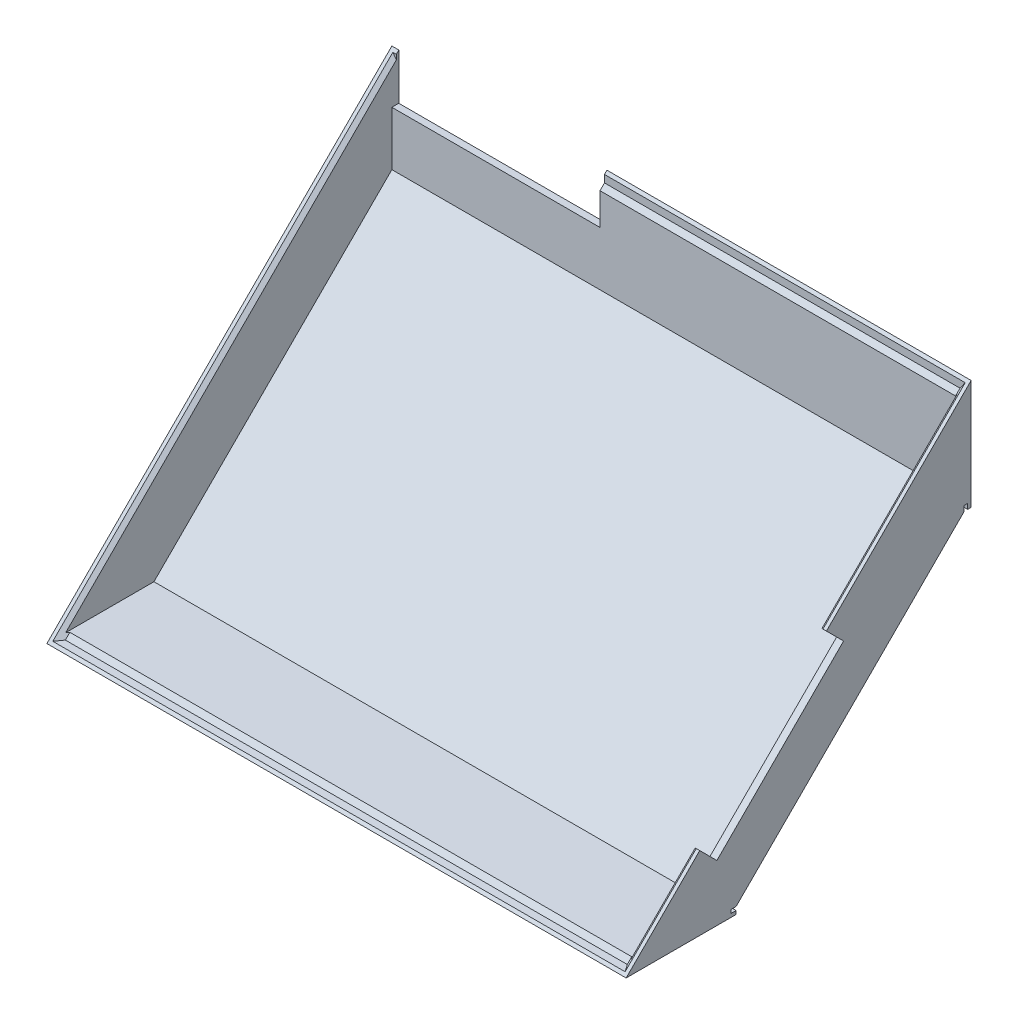
from build123d import *

# Parameters (mm, degrees)
BOSS_EXTRUDE2_DEPTH   = 167
CUT_EXTRUDE2_START    = -2
CUT_EXTRUDE2_DEPTH    = 163
SKETCH6_W             = 1
SKETCH6_H             = 1.5
SKETCH6_W_2           = 1.5
SKETCH6_H_2           = 1
BASE_SLOTS_DEPTH      = 219.342278653
SKETCH7_W             = 165
SKETCH7_H             = 138.656854249
COVER_SLOTS_DEPTH     = 1.5
COVER_SLOTS_DRAFT     = -45
USB_C_SLOTS_REACH     = 220.342
SCREEN_OVERHANG_REACH = 220.342
SKETCH9_W             = 60
SKETCH9_H             = 13.29848481


with BuildPart() as part:
    # Sketch1 → Boss-Extrude2 (new body)
    with BuildSketch(Plane(origin=(0, 0, 0), x_dir=(0, 0, -1), z_dir=(1, 0, 0))):
        Polygon((0, 0), (31.69848481, 0), (31.69848481, 2), (97.45941546, 67.76093065), (99.45941546, 67.76093065), (99.45941546, 99.45941546), align=None)
    extrude(amount=BOSS_EXTRUDE2_DEPTH)

    # Sketch5 → Cut-Extrude2 (cut)
    with BuildSketch(Plane(origin=(167, 0, 0), x_dir=(0, 0, -1), z_dir=(1, 0, 0)).offset(CUT_EXTRUDE2_START)):
        Polygon((97.45941546, 97.45941546), (2, 2), (28.870057685, 2), (97.45941546, 70.589357775), align=None)
    extrude(amount=-CUT_EXTRUDE2_DEPTH, mode=Mode.SUBTRACT)

    # Sketch6 → Base Slots (cut, through all)
    with BuildSketch(Plane(origin=(167, 0, 0), x_dir=(0, 0, -1), z_dir=(1, 0, 0))):
        with Locations((97.95941546, 68.51093065)):
            Rectangle(SKETCH6_W, SKETCH6_H)
        with Locations((30.94848481, 1.5)):
            Rectangle(SKETCH6_W_2, SKETCH6_H_2)
    extrude(amount=-BASE_SLOTS_DEPTH, mode=Mode.SUBTRACT)


with BuildPart() as cover_slots_tool:
    # Sketch7 → Cover slots (with draft: the straight prism first)
    with BuildSketch(Plane(origin=(0, 0, 0), x_dir=(1, 0, 0), z_dir=(0, 0.707106781186551, 0.7071067811865441))):
        with Locations((83.5, 70.328427125)):
            Rectangle(SKETCH7_W, SKETCH7_H)
    extrude(amount=-COVER_SLOTS_DEPTH)
    # Cover slots: the draft: its side faces are tilted about the plane it starts from
    cover_slots_sides = [cover_slots_tool.faces().sort_by_distance(p)[0] for p in [
        (1, 49.199377644, -50.260037816),
        (83.5, 0.176776695, -1.237436867),
        (166, 49.199377644, -50.260037816),
        (83.5, 98.221978593, -99.282638765),
    ]]
    draft(cover_slots_sides, Plane(origin=(0, 0, 0), x_dir=(1, 0, 0), z_dir=(0, 0.707106781186551, 0.7071067811865441)), COVER_SLOTS_DRAFT)


with BuildPart() as part_1:
    add(part.part)

    # Cover slots: cut by cover_slots_tool
    add(cover_slots_tool.part, mode=Mode.SUBTRACT)

    # Sketch8 → USB C Slots (cut, up to next)
    with BuildSketch(Plane(origin=(167, 0, 0), x_dir=(0, 0, -1), z_dir=(1, 0, 0)), mode=Mode.PRIVATE) as usb_c_slots_sk1:
        Polygon((26.162950904, 16.263455967), (62.689862838, 52.790367902), (57.74011537, 57.74011537), (21.213203436, 21.213203436), align=None)
    usb_c_slots_tool1 = extrude(usb_c_slots_sk1.sketch, amount=-USB_C_SLOTS_REACH, mode=Mode.PRIVATE) & part_1.part
    add(usb_c_slots_tool1.solids().sort_by_distance((167, 37.001786, -41.951533))[0], mode=Mode.SUBTRACT)

    # Sketch9 → Screen Overhang (cut, up to next)
    with BuildSketch(Plane(origin=(0, 0, -99.45941546), x_dir=(-1, 0, 0), z_dir=(0, 0, -1)), mode=Mode.PRIVATE) as screen_overhang_sk1:
        with Locations((-32, 92.810173055)):
            Rectangle(SKETCH9_W, SKETCH9_H)
    screen_overhang_tool1 = extrude(screen_overhang_sk1.sketch, amount=-SCREEN_OVERHANG_REACH, mode=Mode.PRIVATE) & part_1.part
    add(screen_overhang_tool1.solids().sort_by_distance((32, 92.810173, -99.459415))[0], mode=Mode.SUBTRACT)


solid = part_1.part
